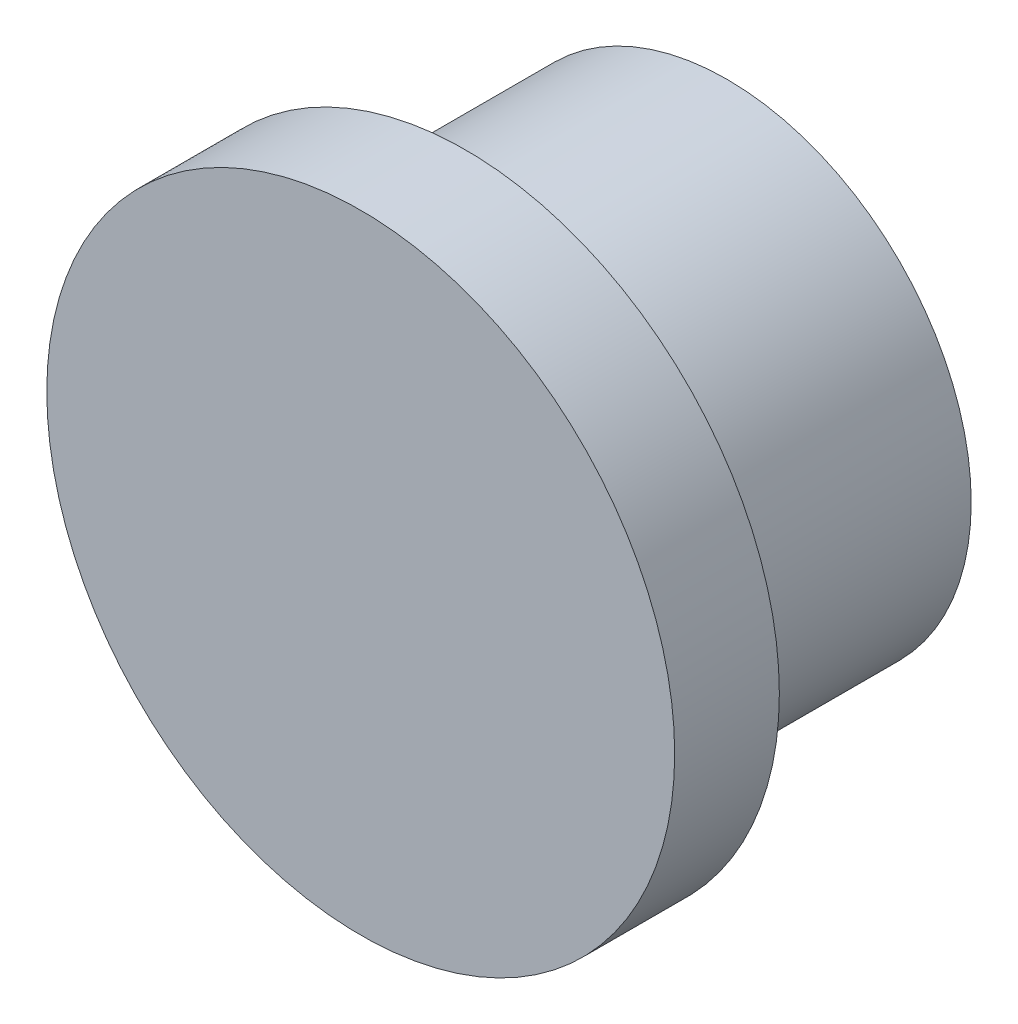
from build123d import *

# Parameters (mm, degrees)
SALIENTE_EXTRUIR1_DEPTH      = 1.75
SALIENTE_EXTRUIR1_DEPTH_BACK = 3.25
CROQUIS1_R                   = 3.5
SALIENTE_EXTRUIR2_DEPTH      = 0.25
SALIENTE_EXTRUIR2_DEPTH_BACK = 1.25
CROQUIS2_R                   = 4.5


with BuildPart() as part:
    # Croquis1 → Saliente-Extruir1 (new, two sides: drawn at the far end of the back side and taken through both)
    with BuildSketch(Plane.XY.offset(-SALIENTE_EXTRUIR1_DEPTH_BACK)):
        with Locations((-11.52520949, -14.691064437)):
            Circle(CROQUIS1_R)
    extrude(amount=SALIENTE_EXTRUIR1_DEPTH + SALIENTE_EXTRUIR1_DEPTH_BACK)

    # Croquis2 → Saliente-Extruir2 (add, two sides: drawn at the far end of the back side and taken through both)
    with BuildSketch(Plane.XY.offset(1.75).offset(-SALIENTE_EXTRUIR2_DEPTH_BACK)):
        with Locations((-11.52520949, -14.691064437)):
            Circle(CROQUIS2_R)
    extrude(amount=SALIENTE_EXTRUIR2_DEPTH + SALIENTE_EXTRUIR2_DEPTH_BACK)


solid = part.part
